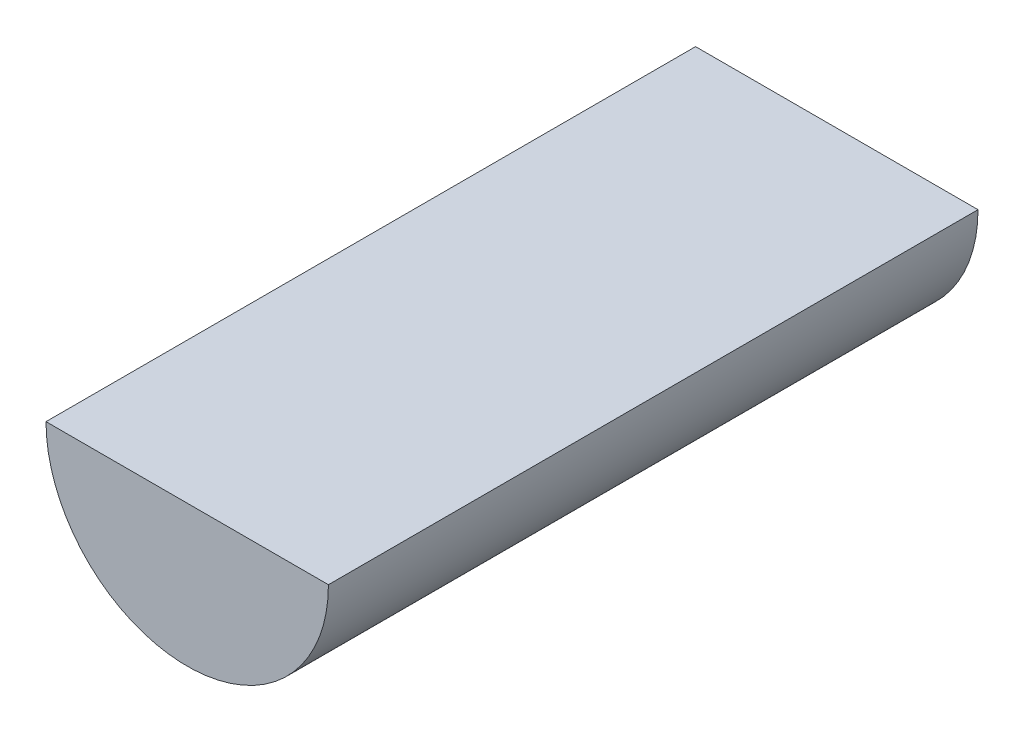
from build123d import *

# Parameters (mm, degrees)
BOSS_EXTRUDE1_DEPTH = 230


with BuildPart() as part:
    # Sketch1 → Boss-Extrude1 (new body)
    with BuildSketch(Plane.XY):
        with BuildLine():
            Line((-50, 0), (50, 0))
            ThreePointArc((50, 0), (0, -50), (-50, 0))
        make_face()
    extrude(amount=BOSS_EXTRUDE1_DEPTH)


solid = part.part
